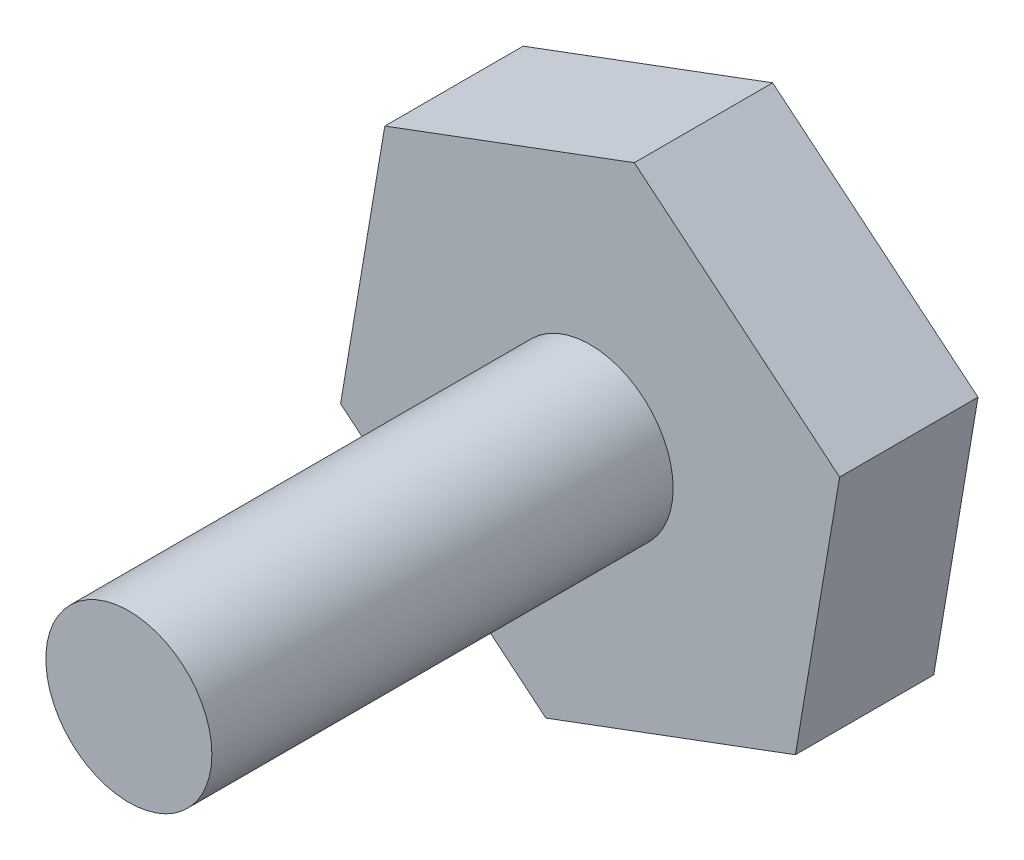
from build123d import *

# Parameters (mm, degrees)
BOSS_EXTRU_1_DEPTH = 3
ESQUISSE2_R        = 1.8
BOSS_EXTRU_2_DEPTH = 10


with BuildPart() as part:
    # Esquisse1 → Boss.-Extru.1 (new body)
    with BuildSketch(Plane.XY):
        Polygon((0.090746241, 0.209409856), (1.049578601, 5.902736989), (-3.401571147, 9.579773737), (-8.811553256, 7.563483353), (-9.770385617, 1.870156221), (-5.319235869, -1.806880528), align=None)
    extrude(amount=BOSS_EXTRU_1_DEPTH)

    # Esquisse2 → Boss.-Extru.2 (add)
    with BuildSketch(Plane.XY.offset(3)):
        with Locations((-4.360403508, 3.886446605)):
            Circle(ESQUISSE2_R)
    extrude(amount=BOSS_EXTRU_2_DEPTH)


solid = part.part
